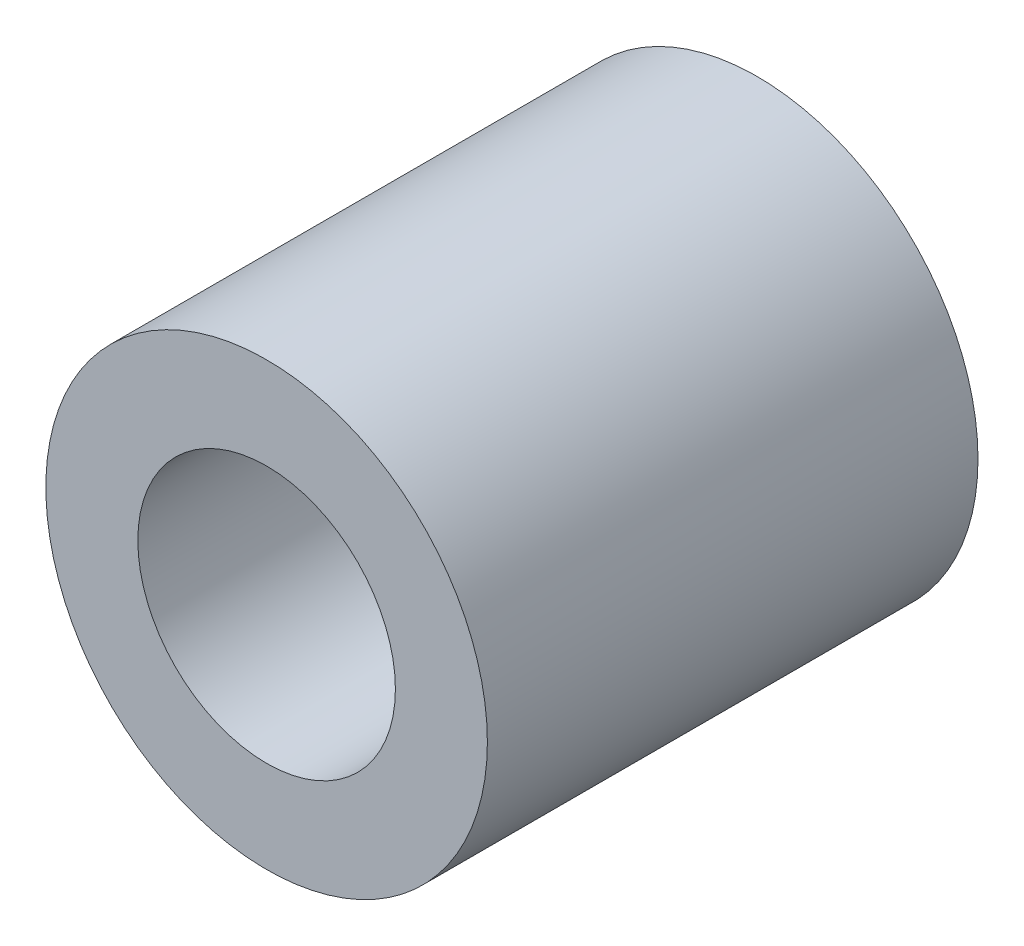
from build123d import *

# Parameters (mm, degrees)
SKETCH_1_R      = 9
SKETCH_1_R_2    = 5.25
EXTRUDE_1_DEPTH = 20


with BuildPart() as part:
    # 草图1 → 拉伸1 (new body)
    with BuildSketch(Plane.XY):
        Circle(SKETCH_1_R)
        Circle(SKETCH_1_R_2, mode=Mode.SUBTRACT)
    extrude(amount=EXTRUDE_1_DEPTH)


solid = part.part
